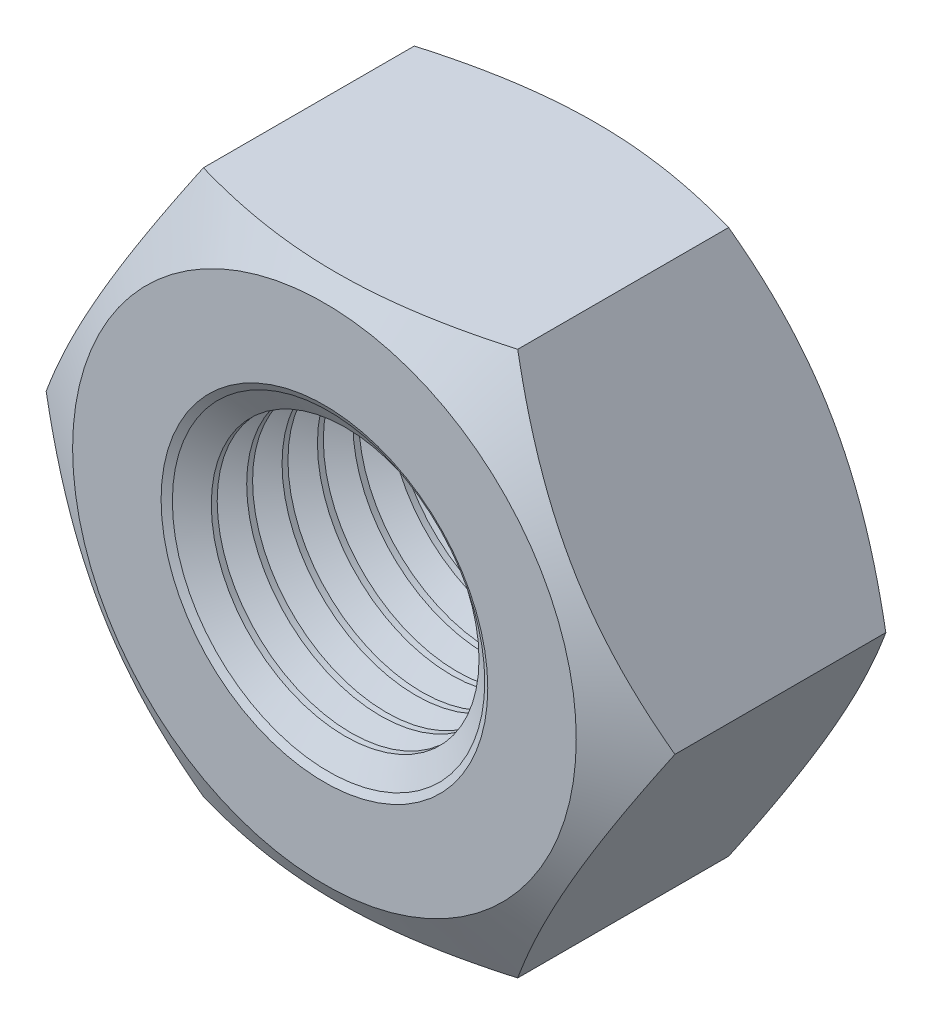
from build123d import *
from OCP.BRepFilletAPI import BRepFilletAPI_MakeChamfer

# Parameters (mm, degrees)
SKETCH1_R        = 2.4585
BASENUT_DEPTH    = 5.2
ENDCHAMFER_SIZE  = 0.5415
ENDCHAMFER_SIZE2 = 0.312635171
LPATTERN10_COUNT = 8
LPATTERN10_PITCH = 0.6498


with BuildPart() as part:
    # Sketch1 → BaseNut (new body)
    with BuildSketch(Plane.XY):
        Polygon((5.773502692, 0), (2.886751346, 5), (-2.886751346, 5), (-5.773502692, 0), (-2.886751346, -5), (2.886751346, -5), align=None)
        Circle(SKETCH1_R, mode=Mode.SUBTRACT)
    extrude(amount=-BASENUT_DEPTH)

    # Sketch2 → Double-Chamfer (revolve, cut)
    with BuildSketch(Plane(origin=(0, 0, 0), x_dir=(1, 0, 0), z_dir=(0, 1, 0))):
        Polygon((-5.773502692, 5.2), (-4.625, 5.2), (-5.773502692, 4.536911662), align=None)
        Polygon((-5.773502692, 0.663088338), (-5.773502692, 0), (-4.625, 0), align=None)
    revolve(axis=Axis((0, 0, -3.375940562), (0, 0, 1)), mode=Mode.SUBTRACT)

    # EndChamfer: one chamfer whose edges measure the first distance from different faces: ONE call of the kernel's chamfer builder (chamfer() names one face for all edges)
    endchamfer_edges_1 = [part.edges().sort_by_distance(p)[0] for p in [
        (-2.4585, 0, -5.2),
    ]]
    endchamfer_side_1 = [part.faces().sort_by_distance(p)[0] for p in [
        (-2.4585, 0, -2.6),
    ]]
    endchamfer_edges_2 = [part.edges().sort_by_distance(p)[0] for p in [
        (-2.4585, 0, 0),
    ]]
    endchamfer_side_2 = [part.faces().sort_by_distance(p)[0] for p in [
        (4.494185245, 0, 0),
    ]]
    endchamfer = BRepFilletAPI_MakeChamfer(part.part.solid().wrapped)
    for e in endchamfer_edges_1:
        endchamfer.Add(ENDCHAMFER_SIZE, ENDCHAMFER_SIZE2, e.wrapped, endchamfer_side_1[0].wrapped)  # the first distance lies on this face
    for e in endchamfer_edges_2:
        endchamfer.Add(ENDCHAMFER_SIZE, ENDCHAMFER_SIZE2, e.wrapped, endchamfer_side_2[0].wrapped)  # the first distance lies on this face
    add(Compound.cast(endchamfer.Shape()), mode=Mode.REPLACE)

    # Sketch3 → Cut-Revolve10 (revolve, cut)
    with BuildSketch(Plane(origin=(0, 0, 0), x_dir=(1, 0, 0), z_dir=(0, 1, 0)), mode=Mode.PRIVATE) as cut_revolve10_sk:
        Polygon((-2.927452756, 4.6585), (-2.4585, 4.38775), (-1.917, 4.38775), (-1.917, 4.92925), (-2.4585, 4.92925), align=None)
    cut_revolve10 = revolve(cut_revolve10_sk.sketch.rotate(Axis((0, 0, -7.438254559), (0, 0, -1)), 180), axis=Axis((0, 0, -7.438254559), (0, 0, -1)), mode=Mode.SUBTRACT)

    # LPattern10: Cut-Revolve10 ×8
    with Locations(*[(0, 0, i * LPATTERN10_PITCH) for i in range(1, LPATTERN10_COUNT)]):
        add(cut_revolve10, mode=Mode.SUBTRACT)


solid = part.part
